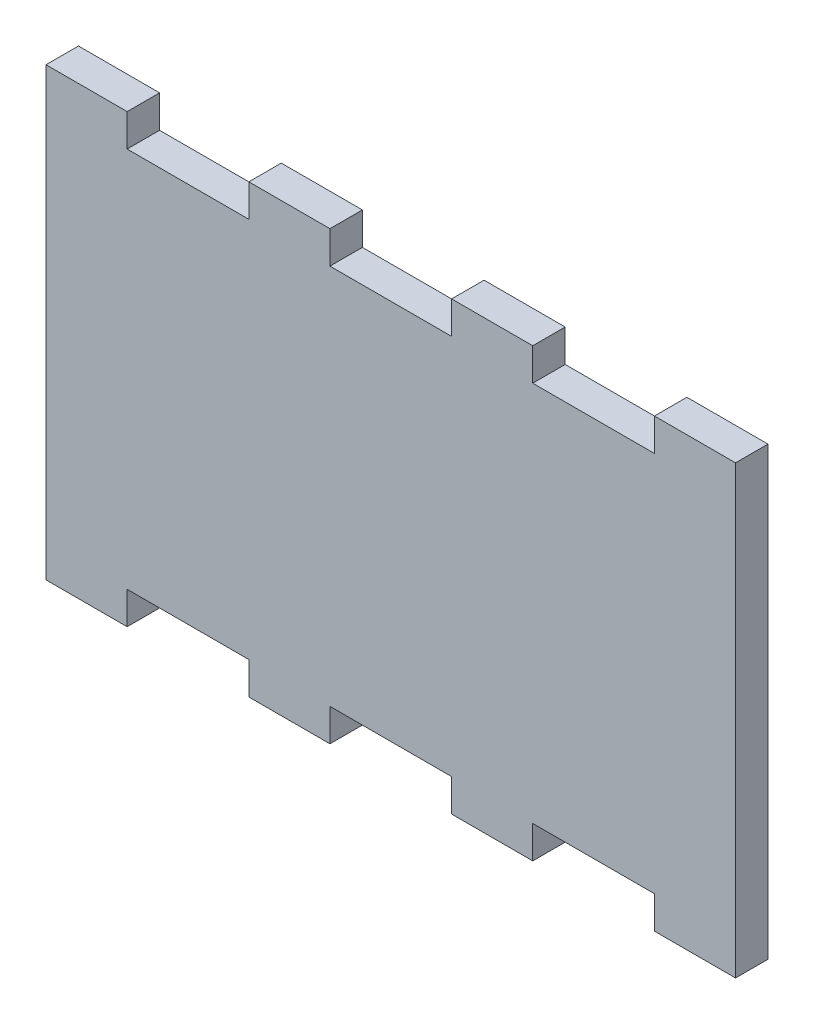
from build123d import *

# Parameters (mm, degrees)
SALIENTE_EXTRUIR1_DEPTH = 4


with BuildPart() as part:
    # Croquis1 → Saliente-Extruir1 (new body)
    with BuildSketch(Plane.XY):
        Polygon((0, 0), (10, 0), (10, 4), (25, 4), (25, 0), (35, 0), (35, 4), (50, 4), (50, 0), (60, 0), (60, 4), (75, 4), (75, 0), (85, 0), (85, 55), (75, 55), (75, 51), (60, 51), (60, 55), (50, 55), (50, 51), (35, 51), (35, 55), (25, 55), (25, 51), (10, 51), (10, 55), (0, 55), align=None)
    extrude(amount=SALIENTE_EXTRUIR1_DEPTH)


solid = part.part
